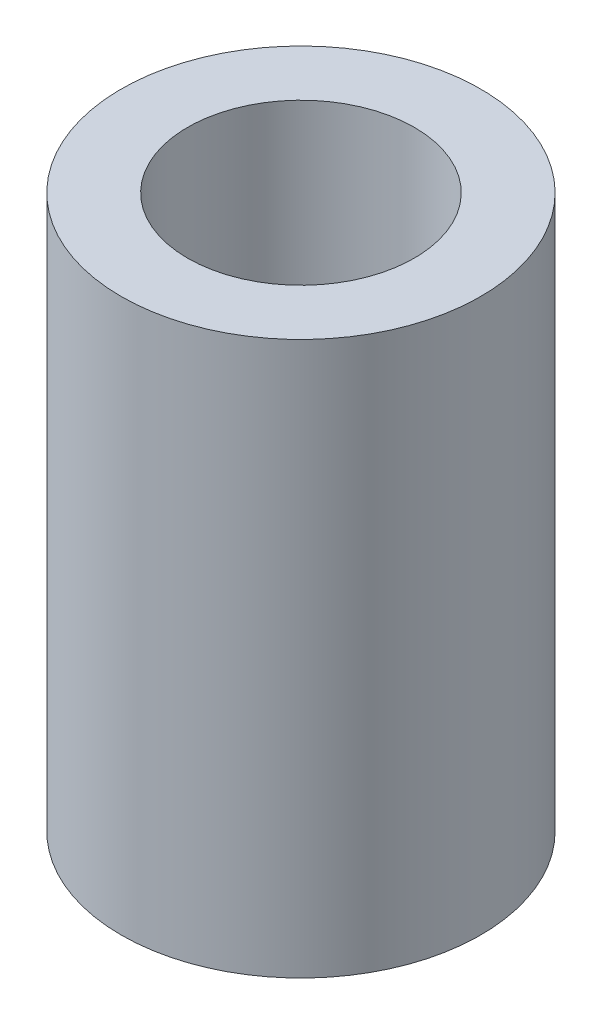
from build123d import *

# Parameters (mm, degrees)
SKETCH1_R           = 6.5
SKETCH1_R_2         = 4.1
BOSS_EXTRUDE1_DEPTH = 20


with BuildPart() as part:
    # Sketch1 → Boss-Extrude1 (new body)
    with BuildSketch(Plane(origin=(0, 0, 0), x_dir=(1, 0, 0), z_dir=(0, 1, 0))):
        with Locations(Location((0, 0, 0), (0, 0, 270))):
            Circle(SKETCH1_R)
        with Locations(Location((0, 0, 0), (0, 0, 270))):
            Circle(SKETCH1_R_2, mode=Mode.SUBTRACT)
    extrude(amount=BOSS_EXTRUDE1_DEPTH)


solid = part.part
